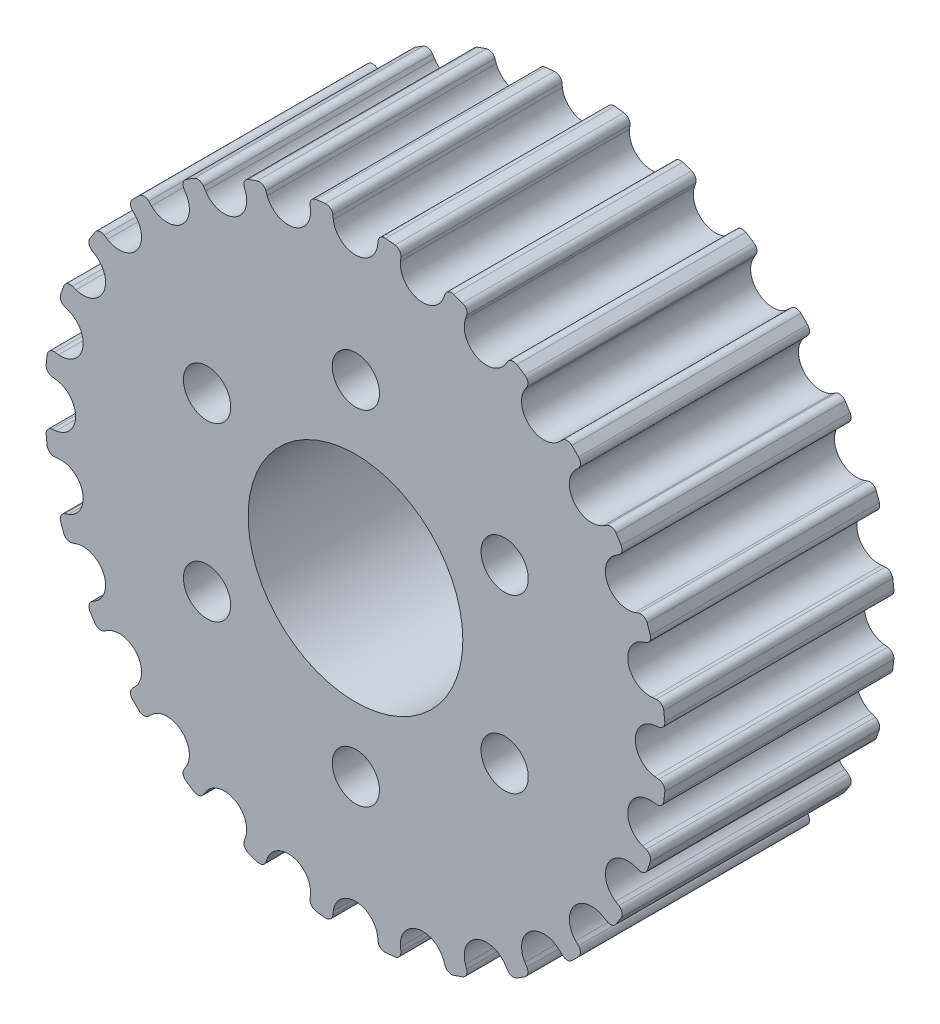
from build123d import *

# Parameters (mm, degrees)
SKETCH_1_R          = 7.5
EXTRUDE_1_DEPTH     = 16
SKETCH_9_R          = 1.65
CUT_EXTRUDE_2_DEPTH = 16


with BuildPart() as part:
    # 草图1 → 凸台-拉伸1 (new body)
    with BuildSketch(Plane.XY):
        with BuildLine():
            Line((1.554033471, 21.184411781), (1.521048557, 20.915771216))
            ThreePointArc((1.521048557, 20.915771216), (-0.027323439, 19.545887392), (-1.575695436, 20.915771216))
            Line((-1.575695436, 20.915771216), (-1.608680349, 21.184411781))
            ThreePointArc((-1.608680349, 21.184411781), (-1.784864491, 21.500423691), (-2.131632272, 21.603653945))
            ThreePointArc((-2.131632272, 21.603653945), (-2.457848286, 21.569392044), (-2.783509374, 21.530205035))
            ThreePointArc((-2.783509374, 21.530205035), (-3.09861207, 21.352399889), (-3.200059642, 21.005106398))
            Line((-3.200059642, 21.005106398), (-3.172439406, 20.735861379))
            ThreePointArc((-3.172439406, 20.735861379), (-4.377162656, 19.055778219), (-6.191541562, 20.046771013))
            Line((-6.191541562, 20.046771013), (-6.283477625, 20.301336364))
            ThreePointArc((-6.283477625, 20.301336364), (-6.525563727, 20.570220536), (-6.886608208, 20.593699501))
            ThreePointArc((-6.886608208, 20.593699501), (-7.197021316, 20.487706726), (-7.505797471, 20.377035808))
            ThreePointArc((-7.505797471, 20.377035808), (-7.773434517, 20.133571662), (-7.795058515, 19.772411335))
            Line((-7.795058515, 19.772411335), (-7.708218122, 19.516062931))
            ThreePointArc((-7.708218122, 19.516062931), (-8.508882771, 17.610026822), (-10.498288052, 18.172436068))
            Line((-10.498288052, 18.172436068), (-10.644565205, 18.400161236))
            ThreePointArc((-10.644565205, 18.400161236), (-10.940414061, 18.608434695), (-11.297630964, 18.550985038))
            ThreePointArc((-11.297630964, 18.550985038), (-11.576675756, 18.378576309), (-11.853083652, 18.201970983))
            ThreePointArc((-11.853083652, 18.201970983), (-12.059834609, 17.905056146), (-12.000550715, 17.54813907))
            Line((-12.000550715, 17.54813907), (-11.858844707, 17.317541662))
            ThreePointArc((-11.858844707, 17.317541662), (-12.215302086, 15.281129211), (-14.279976653, 15.386753363))
            Line((-14.279976653, 15.386753363), (-14.47325995, 15.576219257))
            ThreePointArc((-14.47325995, 15.576219257), (-14.808036462, 15.713438301), (-15.14351344, 15.577940788))
            ThreePointArc((-15.14351344, 15.577940788), (-15.377197445, 15.347761398), (-15.607376836, 15.114077393))
            ThreePointArc((-15.607376836, 15.114077393), (-15.742874348, 14.778600415), (-15.605655304, 14.443823903))
            Line((-15.605655304, 14.443823903), (-15.41618941, 14.250540606))
            ThreePointArc((-15.41618941, 14.250540606), (-15.310565258, 12.185866039), (-17.346977709, 11.829408659))
            Line((-17.346977709, 11.829408659), (-17.577575117, 11.971114668))
            ThreePointArc((-17.577575117, 11.971114668), (-17.934492193, 12.030398562), (-18.23140703, 11.823647605))
            ThreePointArc((-18.23140703, 11.823647605), (-18.408012356, 11.547239709), (-18.580421086, 11.268194917))
            ThreePointArc((-18.580421086, 11.268194917), (-18.637870742, 10.910978014), (-18.429597284, 10.615129158))
            Line((-18.429597284, 10.615129158), (-18.201872116, 10.468852005))
            ThreePointArc((-18.201872116, 10.468852005), (-17.639462869, 8.479446724), (-19.545498979, 7.678782075))
            Line((-19.545498979, 7.678782075), (-19.801847382, 7.765622467))
            ThreePointArc((-19.801847382, 7.765622467), (-20.163007709, 7.74399847), (-20.406471855, 7.476361423))
            ThreePointArc((-20.406471855, 7.476361423), (-20.517142773, 7.167585269), (-20.623135549, 6.857172161))
            ThreePointArc((-20.623135549, 6.857172161), (-20.599656583, 6.49612768), (-20.330772412, 6.254041577))
            Line((-20.330772412, 6.254041577), (-20.07620706, 6.162105515))
            ThreePointArc((-20.07620706, 6.162105515), (-19.085214266, 4.347726609), (-20.765297426, 3.143003359))
            Line((-20.765297426, 3.143003359), (-21.034542445, 3.170623595))
            ThreePointArc((-21.034542445, 3.170623595), (-21.381835936, 3.069176023), (-21.559641082, 2.754073327))
            ThreePointArc((-21.559641082, 2.754073327), (-21.598828091, 2.428412239), (-21.633089992, 2.102196225))
            ThreePointArc((-21.633089992, 2.102196225), (-21.529859738, 1.755428444), (-21.213847828, 1.579244302))
            Line((-21.213847828, 1.579244302), (-20.945207263, 1.546259388))
            ThreePointArc((-20.945207263, 1.546259388), (-19.575323439, -0.002112608), (-20.945207263, -1.550484605))
            Line((-20.945207263, -1.550484605), (-21.213847828, -1.583469519))
            ThreePointArc((-21.213847828, -1.583469519), (-21.529859738, -1.75965366), (-21.633089992, -2.106421441))
            ThreePointArc((-21.633089992, -2.106421441), (-21.598828091, -2.432637455), (-21.559641082, -2.758298543))
            ThreePointArc((-21.559641082, -2.758298543), (-21.381835936, -3.073401239), (-21.034542445, -3.174848812))
            Line((-21.034542445, -3.174848812), (-20.765297426, -3.147228575))
            ThreePointArc((-20.765297426, -3.147228575), (-19.085214266, -4.351951825), (-20.07620706, -6.166330731))
            Line((-20.07620706, -6.166330731), (-20.330772412, -6.258266794))
            ThreePointArc((-20.330772412, -6.258266794), (-20.599656583, -6.500352897), (-20.623135549, -6.861397377))
            ThreePointArc((-20.623135549, -6.861397377), (-20.517142773, -7.171810485), (-20.406471855, -7.48058664))
            ThreePointArc((-20.406471855, -7.48058664), (-20.163007709, -7.748223686), (-19.801847382, -7.769847684))
            Line((-19.801847382, -7.769847684), (-19.545498979, -7.683007291))
            ThreePointArc((-19.545498979, -7.683007291), (-17.639462869, -8.48367194), (-18.201872116, -10.473077221))
            Line((-18.201872116, -10.473077221), (-18.429597284, -10.619354374))
            ThreePointArc((-18.429597284, -10.619354374), (-18.637870742, -10.91520323), (-18.580421086, -11.272420133))
            ThreePointArc((-18.580421086, -11.272420133), (-18.408012356, -11.551464925), (-18.23140703, -11.827872821))
            ThreePointArc((-18.23140703, -11.827872821), (-17.934492193, -12.034623778), (-17.577575117, -11.975339884))
            Line((-17.577575117, -11.975339884), (-17.346977709, -11.833633876))
            ThreePointArc((-17.346977709, -11.833633876), (-15.310565258, -12.190091255), (-15.41618941, -14.254765823))
            Line((-15.41618941, -14.254765823), (-15.605655304, -14.448049119))
            ThreePointArc((-15.605655304, -14.448049119), (-15.742874348, -14.782825631), (-15.607376836, -15.11830261))
            ThreePointArc((-15.607376836, -15.11830261), (-15.377197445, -15.351986614), (-15.14351344, -15.582166005))
            ThreePointArc((-15.14351344, -15.582166005), (-14.808036462, -15.717663517), (-14.47325995, -15.580444473))
            Line((-14.47325995, -15.580444473), (-14.279976653, -15.390978579))
            ThreePointArc((-14.279976653, -15.390978579), (-12.215302086, -15.285354427), (-11.858844707, -17.321766878))
            Line((-11.858844707, -17.321766878), (-12.000550715, -17.552364287))
            ThreePointArc((-12.000550715, -17.552364287), (-12.059834609, -17.909281362), (-11.853083652, -18.206196199))
            ThreePointArc((-11.853083652, -18.206196199), (-11.576675756, -18.382801525), (-11.297630964, -18.555210255))
            ThreePointArc((-11.297630964, -18.555210255), (-10.940414061, -18.612659911), (-10.644565205, -18.404386453))
            Line((-10.644565205, -18.404386453), (-10.498288052, -18.176661285))
            ThreePointArc((-10.498288052, -18.176661285), (-8.508882771, -17.614252038), (-7.708218122, -19.520288148))
            Line((-7.708218122, -19.520288148), (-7.795058515, -19.776636551))
            ThreePointArc((-7.795058515, -19.776636551), (-7.773434517, -20.137796878), (-7.505797471, -20.381261024))
            ThreePointArc((-7.505797471, -20.381261024), (-7.197021316, -20.491931943), (-6.886608208, -20.597924718))
            ThreePointArc((-6.886608208, -20.597924718), (-6.525563727, -20.574445752), (-6.283477625, -20.305561581))
            Line((-6.283477625, -20.305561581), (-6.191541562, -20.050996229))
            ThreePointArc((-6.191541562, -20.050996229), (-4.377162656, -19.060003436), (-3.172439406, -20.740086595))
            Line((-3.172439406, -20.740086595), (-3.200059642, -21.009331614))
            ThreePointArc((-3.200059642, -21.009331614), (-3.09861207, -21.356625105), (-2.783509374, -21.534430251))
            ThreePointArc((-2.783509374, -21.534430251), (-2.457848286, -21.573617261), (-2.131632272, -21.607879161))
            ThreePointArc((-2.131632272, -21.607879161), (-1.784864491, -21.504648907), (-1.608680349, -21.188636997))
            Line((-1.608680349, -21.188636997), (-1.575695436, -20.919996432))
            ThreePointArc((-1.575695436, -20.919996432), (-0.027323439, -19.550112608), (1.521048557, -20.919996432))
            Line((1.521048557, -20.919996432), (1.554033471, -21.188636997))
            ThreePointArc((1.554033471, -21.188636997), (1.730217613, -21.504648907), (2.076985394, -21.607879161))
            ThreePointArc((2.076985394, -21.607879161), (2.403201408, -21.573617261), (2.728862496, -21.534430251))
            ThreePointArc((2.728862496, -21.534430251), (3.043965192, -21.356625105), (3.145412764, -21.009331614))
            Line((3.145412764, -21.009331614), (3.117792528, -20.740086595))
            ThreePointArc((3.117792528, -20.740086595), (4.322515778, -19.060003436), (6.136894684, -20.050996229))
            Line((6.136894684, -20.050996229), (6.228830746, -20.305561581))
            ThreePointArc((6.228830746, -20.305561581), (6.470916849, -20.574445752), (6.83196133, -20.597924718))
            ThreePointArc((6.83196133, -20.597924718), (7.142374438, -20.491931943), (7.451150593, -20.381261024))
            ThreePointArc((7.451150593, -20.381261024), (7.718787639, -20.137796878), (7.740411637, -19.776636551))
            Line((7.740411637, -19.776636551), (7.653571244, -19.520288148))
            ThreePointArc((7.653571244, -19.520288148), (8.454235893, -17.614252038), (10.443641174, -18.176661285))
            Line((10.443641174, -18.176661285), (10.589918327, -18.404386453))
            ThreePointArc((10.589918327, -18.404386453), (10.885767183, -18.612659911), (11.242984086, -18.555210255))
            ThreePointArc((11.242984086, -18.555210255), (11.522028878, -18.382801525), (11.798436774, -18.206196199))
            ThreePointArc((11.798436774, -18.206196199), (12.005187731, -17.909281362), (11.945903837, -17.552364287))
            Line((11.945903837, -17.552364287), (11.804197828, -17.321766878))
            ThreePointArc((11.804197828, -17.321766878), (12.160655208, -15.285354427), (14.225329775, -15.390978579))
            Line((14.225329775, -15.390978579), (14.418613072, -15.580444473))
            ThreePointArc((14.418613072, -15.580444473), (14.753389584, -15.717663517), (15.088866562, -15.582166005))
            ThreePointArc((15.088866562, -15.582166005), (15.322550567, -15.351986614), (15.552729958, -15.11830261))
            ThreePointArc((15.552729958, -15.11830261), (15.68822747, -14.782825631), (15.551008426, -14.448049119))
            Line((15.551008426, -14.448049119), (15.361542532, -14.254765823))
            ThreePointArc((15.361542532, -14.254765823), (15.25591838, -12.190091255), (17.292330831, -11.833633876))
            Line((17.292330831, -11.833633876), (17.522928239, -11.975339884))
            ThreePointArc((17.522928239, -11.975339884), (17.879845315, -12.034623778), (18.176760152, -11.827872821))
            ThreePointArc((18.176760152, -11.827872821), (18.353365478, -11.551464925), (18.525774208, -11.272420133))
            ThreePointArc((18.525774208, -11.272420133), (18.583223864, -10.91520323), (18.374950406, -10.619354374))
            Line((18.374950406, -10.619354374), (18.147225238, -10.473077221))
            ThreePointArc((18.147225238, -10.473077221), (17.584815991, -8.48367194), (19.4908521, -7.683007291))
            Line((19.4908521, -7.683007291), (19.747200504, -7.769847684))
            ThreePointArc((19.747200504, -7.769847684), (20.108360831, -7.748223686), (20.351824977, -7.48058664))
            ThreePointArc((20.351824977, -7.48058664), (20.462495895, -7.171810485), (20.568488671, -6.861397377))
            ThreePointArc((20.568488671, -6.861397377), (20.545009705, -6.500352897), (20.276125534, -6.258266794))
            Line((20.276125534, -6.258266794), (20.021560182, -6.166330731))
            ThreePointArc((20.021560182, -6.166330731), (19.030567388, -4.351951825), (20.710650548, -3.147228575))
            Line((20.710650548, -3.147228575), (20.979895567, -3.174848812))
            ThreePointArc((20.979895567, -3.174848812), (21.327189058, -3.073401239), (21.504994204, -2.758298543))
            ThreePointArc((21.504994204, -2.758298543), (21.544181213, -2.432637455), (21.578443114, -2.106421441))
            ThreePointArc((21.578443114, -2.106421441), (21.47521286, -1.75965366), (21.15920095, -1.583469519))
            Line((21.15920095, -1.583469519), (20.890560385, -1.550484605))
            ThreePointArc((20.890560385, -1.550484605), (19.520676561, -0.002112608), (20.890560385, 1.546259388))
            Line((20.890560385, 1.546259388), (21.15920095, 1.579244302))
            ThreePointArc((21.15920095, 1.579244302), (21.47521286, 1.755428444), (21.578443114, 2.102196225))
            ThreePointArc((21.578443114, 2.102196225), (21.544181213, 2.428412239), (21.504994204, 2.754073327))
            ThreePointArc((21.504994204, 2.754073327), (21.327189058, 3.069176023), (20.979895567, 3.170623595))
            Line((20.979895567, 3.170623595), (20.710650548, 3.143003359))
            ThreePointArc((20.710650548, 3.143003359), (19.030567388, 4.347726609), (20.021560182, 6.162105515))
            Line((20.021560182, 6.162105515), (20.276125534, 6.254041577))
            ThreePointArc((20.276125534, 6.254041577), (20.545009705, 6.49612768), (20.568488671, 6.857172161))
            ThreePointArc((20.568488671, 6.857172161), (20.462495895, 7.167585269), (20.351824977, 7.476361423))
            ThreePointArc((20.351824977, 7.476361423), (20.108360831, 7.74399847), (19.747200504, 7.765622467))
            Line((19.747200504, 7.765622467), (19.4908521, 7.678782075))
            ThreePointArc((19.4908521, 7.678782075), (17.584815991, 8.479446724), (18.147225238, 10.468852005))
            Line((18.147225238, 10.468852005), (18.374950406, 10.615129158))
            ThreePointArc((18.374950406, 10.615129158), (18.583223864, 10.910978014), (18.525774208, 11.268194917))
            ThreePointArc((18.525774208, 11.268194917), (18.353365478, 11.547239709), (18.176760152, 11.823647605))
            ThreePointArc((18.176760152, 11.823647605), (17.879845315, 12.030398562), (17.522928239, 11.971114668))
            Line((17.522928239, 11.971114668), (17.292330831, 11.829408659))
            ThreePointArc((17.292330831, 11.829408659), (15.25591838, 12.185866039), (15.361542532, 14.250540606))
            Line((15.361542532, 14.250540606), (15.551008426, 14.443823903))
            ThreePointArc((15.551008426, 14.443823903), (15.68822747, 14.778600415), (15.552729958, 15.114077393))
            ThreePointArc((15.552729958, 15.114077393), (15.322550567, 15.347761398), (15.088866562, 15.577940788))
            ThreePointArc((15.088866562, 15.577940788), (14.753389584, 15.713438301), (14.418613072, 15.576219257))
            Line((14.418613072, 15.576219257), (14.225329775, 15.386753363))
            ThreePointArc((14.225329775, 15.386753363), (12.160655208, 15.281129211), (11.804197828, 17.317541662))
            Line((11.804197828, 17.317541662), (11.945903837, 17.54813907))
            ThreePointArc((11.945903837, 17.54813907), (12.005187731, 17.905056146), (11.798436774, 18.201970983))
            ThreePointArc((11.798436774, 18.201970983), (11.522028878, 18.378576309), (11.242984086, 18.550985038))
            ThreePointArc((11.242984086, 18.550985038), (10.885767183, 18.608434695), (10.589918327, 18.400161236))
            Line((10.589918327, 18.400161236), (10.443641174, 18.172436068))
            ThreePointArc((10.443641174, 18.172436068), (8.454235893, 17.610026822), (7.653571244, 19.516062931))
            Line((7.653571244, 19.516062931), (7.740411637, 19.772411335))
            ThreePointArc((7.740411637, 19.772411335), (7.718787639, 20.133571662), (7.451150593, 20.377035808))
            ThreePointArc((7.451150593, 20.377035808), (7.142374438, 20.487706726), (6.83196133, 20.593699501))
            ThreePointArc((6.83196133, 20.593699501), (6.470916849, 20.570220536), (6.228830746, 20.301336364))
            Line((6.228830746, 20.301336364), (6.136894684, 20.046771013))
            ThreePointArc((6.136894684, 20.046771013), (4.322515778, 19.055778219), (3.117792528, 20.735861379))
            Line((3.117792528, 20.735861379), (3.145412764, 21.005106398))
            ThreePointArc((3.145412764, 21.005106398), (3.043965192, 21.352399889), (2.728862496, 21.530205035))
            ThreePointArc((2.728862496, 21.530205035), (2.403201408, 21.569392044), (2.076985394, 21.603653945))
            ThreePointArc((2.076985394, 21.603653945), (1.730217613, 21.500423691), (1.554033471, 21.184411781))
        make_face()
        with Locations((-0.027323439, -0.002112608)):
            Circle(SKETCH_1_R, mode=Mode.SUBTRACT)
    extrude(amount=EXTRUDE_1_DEPTH)

    # 草图9 → 切除-拉伸2 (cut)
    with BuildSketch(Plane(origin=(0, 0, 0), x_dir=(-1, 0, 0), z_dir=(0, 0, -1))):
        with Locations((0, 12)):
            Circle(SKETCH_9_R)
        with Locations((10.392304845, 6)):
            Circle(SKETCH_9_R)
        with Locations((10.392304845, -6)):
            Circle(SKETCH_9_R)
        with Locations((0, -12)):
            Circle(SKETCH_9_R)
        with Locations((-10.392304845, -6)):
            Circle(SKETCH_9_R)
        with Locations((-10.392304845, 6)):
            Circle(SKETCH_9_R)
    extrude(amount=-CUT_EXTRUDE_2_DEPTH, mode=Mode.SUBTRACT)


solid = part.part
